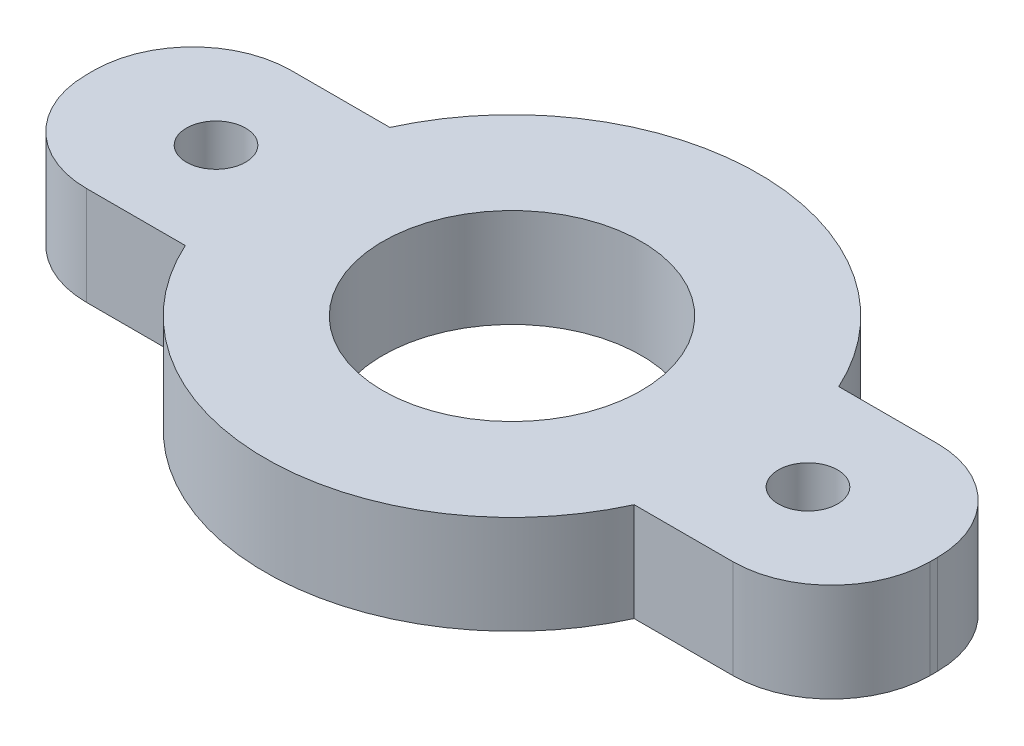
from build123d import *

# Parameters (mm, degrees)
SKETCH1_R           = 6.55
SKETCH1_R_2         = 1.5
BOSS_EXTRUDE1_DEPTH = 5


with BuildPart() as part:
    # Sketch1 → Boss-Extrude1 (new body)
    with BuildSketch(Plane(origin=(0, 0, 0), x_dir=(1, 0, 0), z_dir=(0, 1, 0))):
        with BuildLine():
            Line((-11.374484431, 5.183734554), (-16.374484431, 5.183734554))
            ThreePointArc((-16.374484431, 5.183734554), (-19.910018337, 3.71926846), (-21.374484431, 0.183734554))
            Line((-21.374484431, 0.183734554), (-21.374484431, -0.183734554))
            ThreePointArc((-21.374484431, -0.183734554), (-19.910018337, -3.71926846), (-16.374484431, -5.183734554))
            Line((-16.374484431, -5.183734554), (-11.374484431, -5.183734554))
            ThreePointArc((-11.374484431, -5.183734554), (0, -12.5), (11.374484431, -5.183734554))
            Line((11.374484431, -5.183734554), (16.374484431, -5.183734554))
            ThreePointArc((16.374484431, -5.183734554), (19.910018337, -3.71926846), (21.374484431, -0.183734554))
            Line((21.374484431, -0.183734554), (21.374484431, 0.183734554))
            ThreePointArc((21.374484431, 0.183734554), (19.910018337, 3.71926846), (16.374484431, 5.183734554))
            Line((16.374484431, 5.183734554), (11.374484431, 5.183734554))
            ThreePointArc((11.374484431, 5.183734554), (0, 12.5), (-11.374484431, 5.183734554))
        make_face()
        with Locations(Location((0, 0, 0), (0, 0, 270))):
            Circle(SKETCH1_R, mode=Mode.SUBTRACT)
        with Locations(Location((-15, 0, 0), (0, 0, 270))):
            Circle(SKETCH1_R_2, mode=Mode.SUBTRACT)
        with Locations(Location((15, 0, 0), (0, 0, 270))):
            Circle(SKETCH1_R_2, mode=Mode.SUBTRACT)
    extrude(amount=BOSS_EXTRUDE1_DEPTH)


solid = part.part
